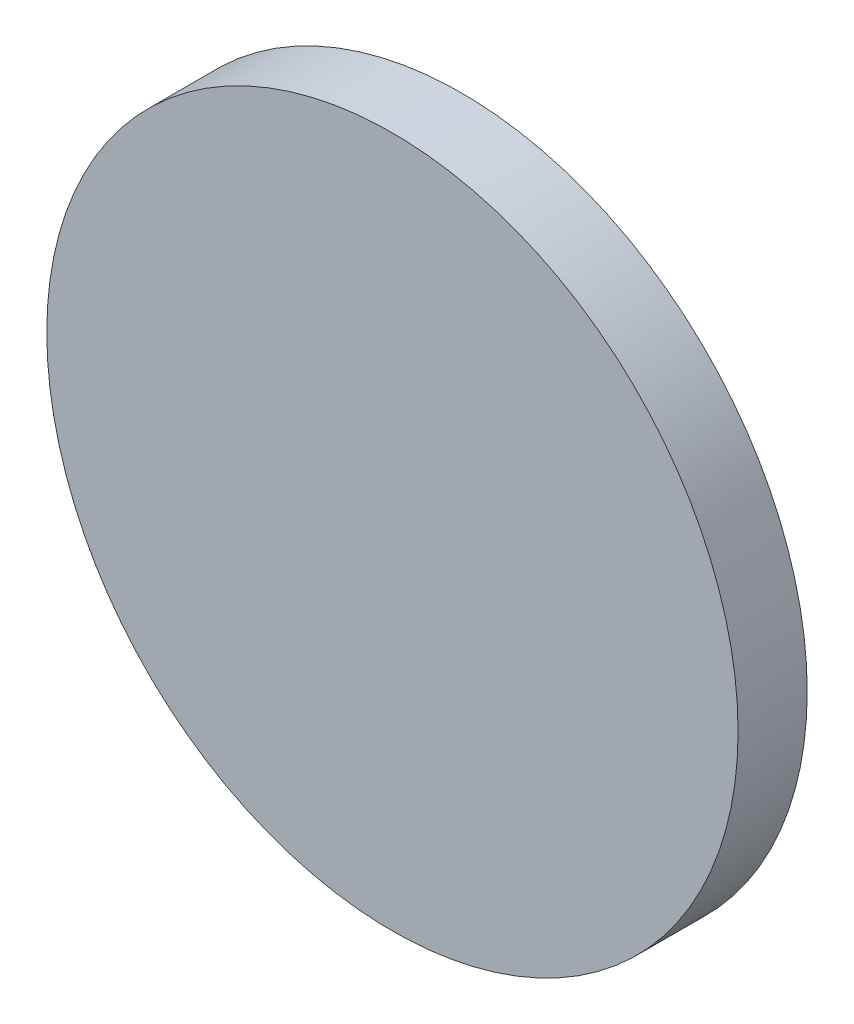
from build123d import *

# Parameters (mm, degrees)
SKETCH1_R          = 50
BASE_EXTRUDE_DEPTH = 10


with BuildPart() as part:
    # Sketch1 → Base-Extrude (new body)
    with BuildSketch(Plane.XY.offset(110.55)):
        Circle(SKETCH1_R)
    extrude(amount=-BASE_EXTRUDE_DEPTH)


solid = part.part
